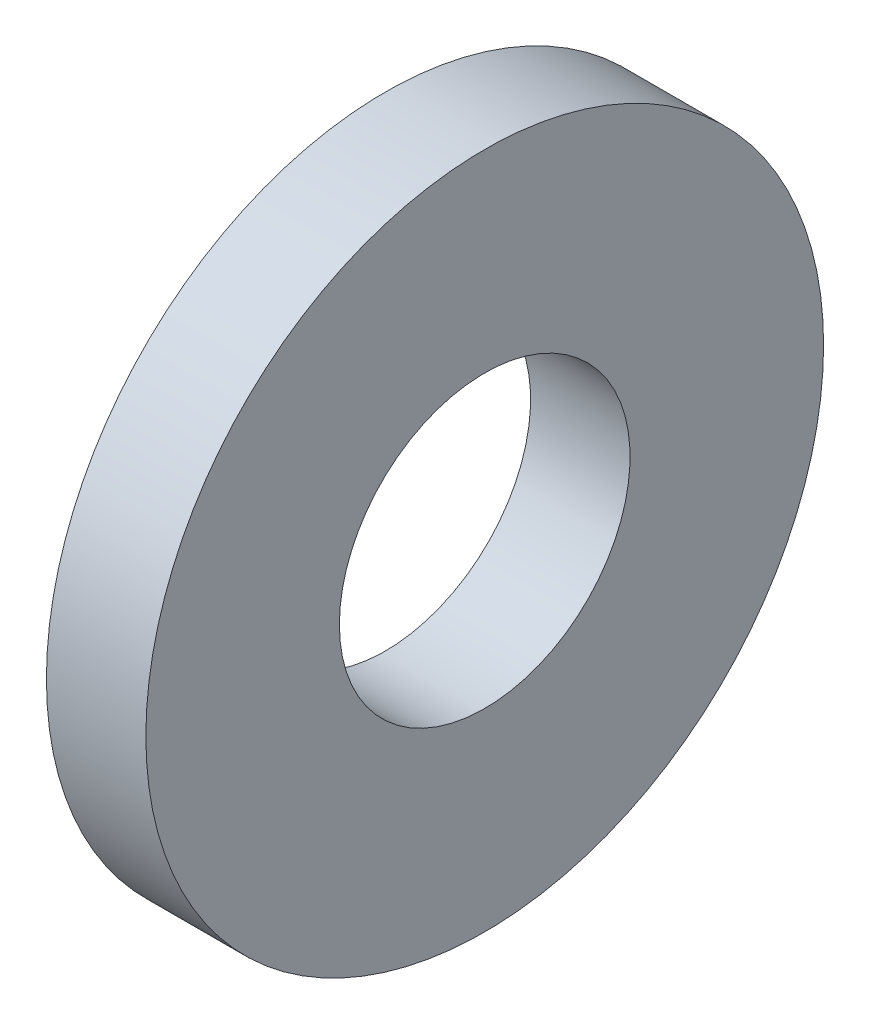
from build123d import *

# Parameters (mm, degrees)
SKETCH1_R           = 5.6261
SKETCH1_R_2         = 2.413
BOSS_EXTRUDE1_DEPTH = 1.651


with BuildPart() as part:
    # Sketch1 → Boss-Extrude1 (new body)
    with BuildSketch(Plane(origin=(0, 0, 0), x_dir=(0, 0, -1), z_dir=(1, 0, 0))):
        with Locations(Location((0, 0, 0), (0, 0, 180))):
            Circle(SKETCH1_R)
        with Locations(Location((0, 0, 0), (0, 0, 180))):
            Circle(SKETCH1_R_2, mode=Mode.SUBTRACT)
    extrude(amount=BOSS_EXTRUDE1_DEPTH)


solid = part.part
